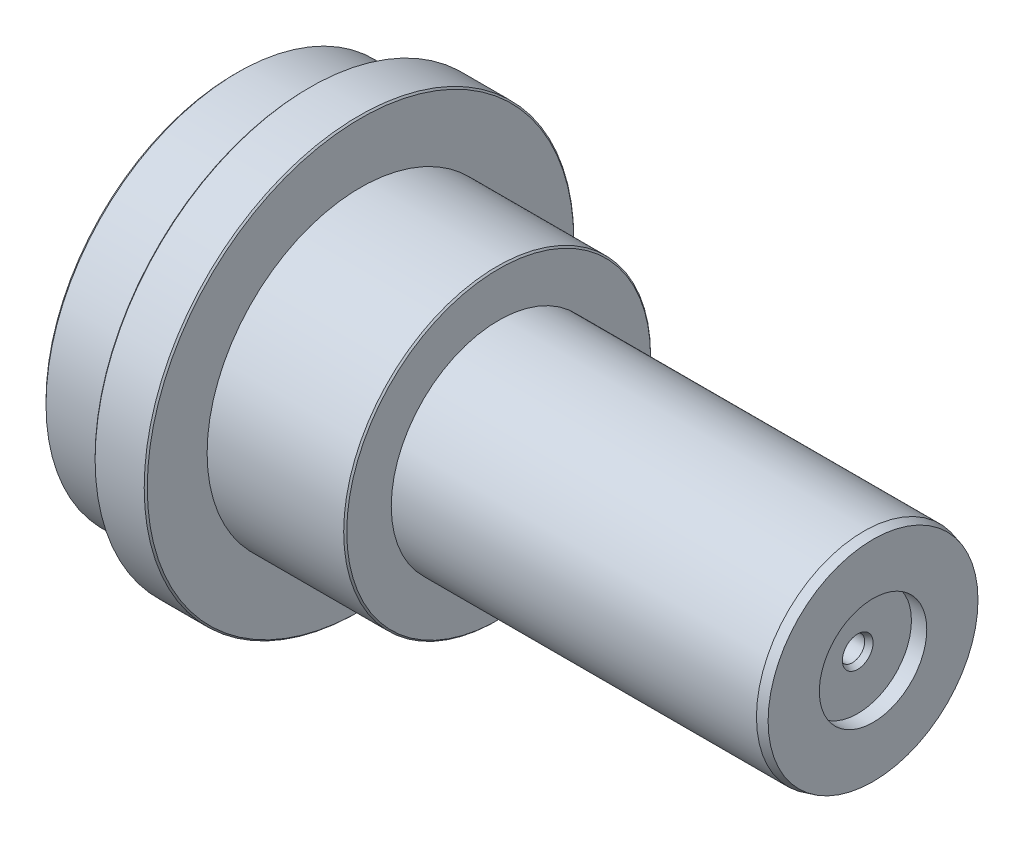
from build123d import *
from OCP.BRepFilletAPI import BRepFilletAPI_MakeChamfer

# Parameters (mm, degrees)
SKETCH_1_W                = 17
SKETCH_1_H                = 70
SKETCH_2_R                = 62.5
EXTRUDE_1_DEPTH           = 24
SKETCH_3_R                = 50
EXTRUDE_2_DEPTH           = 45
SKETCH_4_R                = 35
EXTRUDE_3_DEPTH           = 122
HOLE_WIZARD_3_D           = 8
HOLE_WIZARD_3_DEPTH       = 15
HOLE_WIZARD_3_CBORE_D     = 35
HOLE_WIZARD_3_CBORE_DEPTH = 5
HOLE_WIZARD_3_TIP         = 2.403442476
HOLE_WIZARD_5_D           = 8
HOLE_WIZARD_5_DEPTH       = 12
HOLE_WIZARD_5_CBORE_D     = 25
HOLE_WIZARD_5_CBORE_DEPTH = 2
HOLE_WIZARD_5_TIP         = 2.403442476
CHAMFER_2_SIZE            = 0.803847576
CHAMFER_2_SIZE2           = 3
CHAMFER_3_SIZE            = 0.999999999
CHAMFER_3_SIZE2           = 1.732050808
CHAMFER_4_SIZE            = 0.5
CHAMFER_5_SIZE            = 0.999999999
CHAMFER_5_SIZE2           = 1.000000001


with BuildPart() as part:
    # 草圖1 → 旋轉1 (revolve)
    with BuildSketch(Plane(origin=(0, 0, 0), x_dir=(-1, 0, 0), z_dir=(0, 0, -1)), mode=Mode.PRIVATE) as revolve_1_sk:
        with Locations((-32.5, 35)):
            Rectangle(SKETCH_1_W, SKETCH_1_H)
    revolve(revolve_1_sk.sketch.rotate(Axis((41, 0, 0), (-1, 0, 0)), 270), axis=Axis((41, 0, 0), (-1, 0, 0)))

    # 草圖2 → 填料-伸長1 (add)
    with BuildSketch(Plane.ZY.offset(-24)):
        Circle(SKETCH_2_R)
    extrude(amount=EXTRUDE_1_DEPTH)

    # 草圖3 → 填料-伸長2 (add)
    with BuildSketch(Plane(origin=(41, 0, 0), x_dir=(0, 0, -1), z_dir=(1, 0, 0))):
        with Locations(Location((0, 0, 0), (0, 0, 180))):
            Circle(SKETCH_3_R)
    extrude(amount=EXTRUDE_2_DEPTH)

    # 草圖4 → 填料-伸長3 (add)
    with BuildSketch(Plane(origin=(86, 0, 0), x_dir=(0, 0, -1), z_dir=(1, 0, 0))):
        with Locations(Location((0, 0, 0), (0, 0, 180))):
            Circle(SKETCH_4_R)
    extrude(amount=EXTRUDE_3_DEPTH)

    # 鑽孔3
    with Locations(Plane(origin=(208, 0, 0), x_dir=(0, 0, -1), z_dir=(1, 0, 0))):
        with Locations((0, 0)):
            CounterBoreHole(HOLE_WIZARD_3_D / 2, HOLE_WIZARD_3_CBORE_D / 2, HOLE_WIZARD_3_CBORE_DEPTH, depth=HOLE_WIZARD_3_DEPTH)
            with Locations((0, 0, -(HOLE_WIZARD_3_DEPTH + HOLE_WIZARD_3_TIP / 2))):  # 118° drill point
                Cone(0, HOLE_WIZARD_3_D / 2, HOLE_WIZARD_3_TIP, mode=Mode.SUBTRACT)

    # 鑽孔5
    with Locations(Plane.ZY):
        with Locations((0, 0)):
            CounterBoreHole(HOLE_WIZARD_5_D / 2, HOLE_WIZARD_5_CBORE_D / 2, HOLE_WIZARD_5_CBORE_DEPTH, depth=HOLE_WIZARD_5_DEPTH)
            with Locations((0, 0, -(HOLE_WIZARD_5_DEPTH + HOLE_WIZARD_5_TIP / 2))):  # 118° drill point
                Cone(0, HOLE_WIZARD_5_D / 2, HOLE_WIZARD_5_TIP, mode=Mode.SUBTRACT)

    # 導角2
    chamfer_2_edges = [part.edges().sort_by_distance(p)[0] for p in [
        (208, 0, -35),
    ]]
    chamfer_2_side = [part.faces().sort_by_distance(p)[0] for p in [
        (208, 0, -34.010050506),
    ]]
    chamfer(chamfer_2_edges, length=CHAMFER_2_SIZE, length2=CHAMFER_2_SIZE2, reference=chamfer_2_side[0])

    # 導角3: one chamfer whose edges measure the first distance from different faces: ONE call of the kernel's chamfer builder (chamfer() names one face for all edges)
    chamfer_3_edges_1 = [part.edges().sort_by_distance(p)[0] for p in [
        (203, 0, -4),
    ]]
    chamfer_3_side_1 = [part.faces().sort_by_distance(p)[0] for p in [
        (203, 0, 17.005025253),
    ]]
    chamfer_3_edges_2 = [part.edges().sort_by_distance(p)[0] for p in [
        (2, 0, 4),
    ]]
    chamfer_3_side_2 = [part.faces().sort_by_distance(p)[0] for p in [
        (2, 0, -12.146446609),
    ]]
    chamfer_3 = BRepFilletAPI_MakeChamfer(part.part.solid().wrapped)
    for e in chamfer_3_edges_1:
        chamfer_3.Add(CHAMFER_3_SIZE, CHAMFER_3_SIZE2, e.wrapped, chamfer_3_side_1[0].wrapped)  # the first distance lies on this face
    for e in chamfer_3_edges_2:
        chamfer_3.Add(CHAMFER_3_SIZE, CHAMFER_3_SIZE2, e.wrapped, chamfer_3_side_2[0].wrapped)  # the first distance lies on this face
    add(Compound.cast(chamfer_3.Shape()), mode=Mode.REPLACE)

    # 導角4
    chamfer_4_edges = [part.edges().sort_by_distance(p)[0] for p in [
        (86, 0, -50),
        (24, 0, -70),
        (41, 0, -70),
    ]]
    chamfer(chamfer_4_edges, length=CHAMFER_4_SIZE)

    # 導角5
    chamfer_5_edges = [part.edges().sort_by_distance(p)[0] for p in [
        (0, 0, -62.5),
    ]]
    chamfer_5_side = [part.faces().sort_by_distance(p)[0] for p in [
        (12, 0, -62.5),
    ]]
    chamfer(chamfer_5_edges, length=CHAMFER_5_SIZE, length2=CHAMFER_5_SIZE2, reference=chamfer_5_side[0])


solid = part.part
